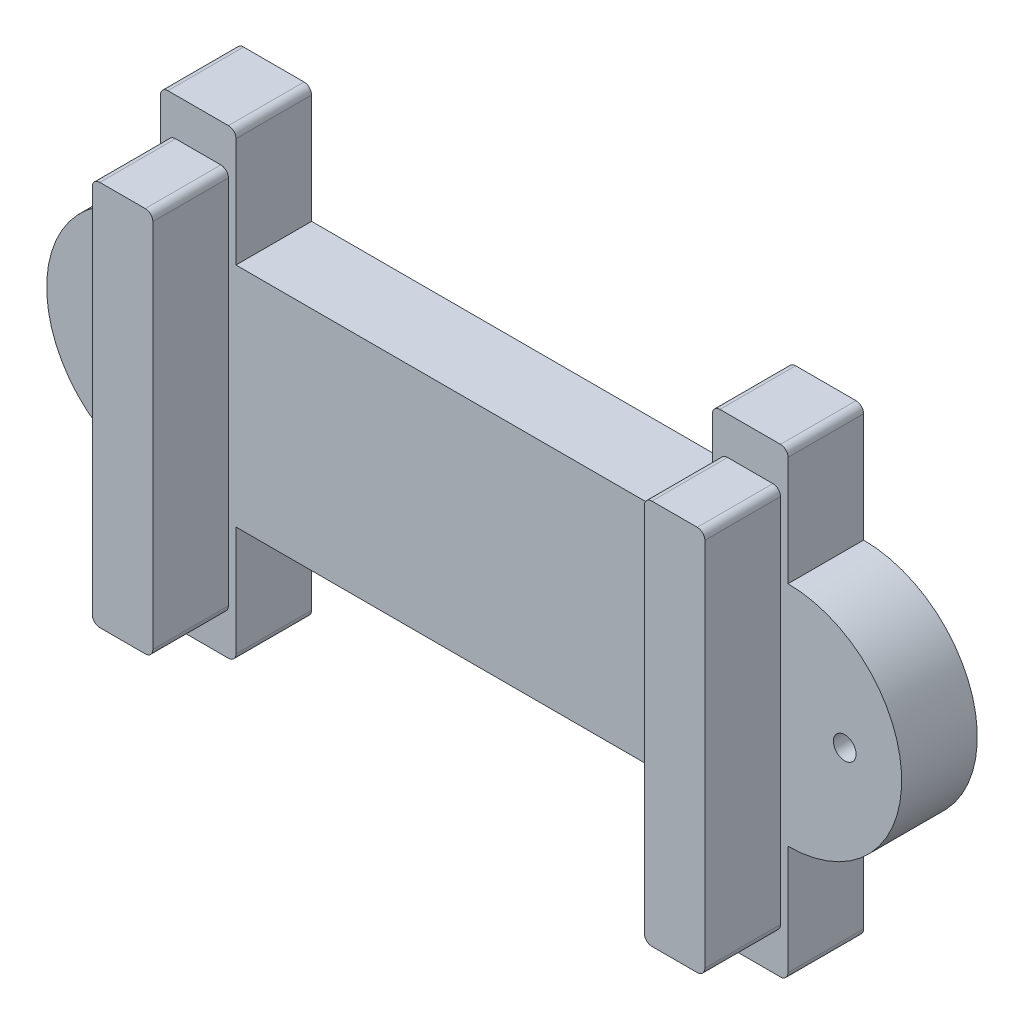
from build123d import *

# Parameters (mm, degrees)
SKETCH1_R           = 1.5
BOSS_EXTRUDE1_DEPTH = 10
BOSS_EXTRUDE2_DEPTH = 10


with BuildPart() as part:
    # Sketch1 → Boss-Extrude1 (new body)
    with BuildSketch(Plane.XY):
        with BuildLine():
            Line((31.5, -15), (-31.5, -15))
            Line((-31.5, -15), (-31.5, -29.533829211))
            ThreePointArc((-31.5, -29.533829211), (-31.792893219, -30.240935993), (-32.5, -30.533829211))
            Line((-32.5, -30.533829211), (-40.5, -30.533829211))
            ThreePointArc((-40.5, -30.533829211), (-41.207106781, -30.240935993), (-41.5, -29.533829211))
            Line((-41.5, -29.533829211), (-41.5, -15.067658423))
            ThreePointArc((-41.5, -15.067658423), (-56.533829211, -0.033829211), (-41.5, 15))
            Line((-41.5, 15), (-41.5, 29.466170789))
            ThreePointArc((-41.5, 29.466170789), (-41.207106781, 30.17327757), (-40.5, 30.466170789))
            Line((-40.5, 30.466170789), (-32.5, 30.466170789))
            ThreePointArc((-32.5, 30.466170789), (-31.792893219, 30.17327757), (-31.5, 29.466170789))
            Line((-31.5, 29.466170789), (-31.5, 15))
            Line((-31.5, 15), (31.5, 15))
            Line((31.5, 15), (31.5, 29.466170789))
            ThreePointArc((31.5, 29.466170789), (31.792893219, 30.17327757), (32.5, 30.466170789))
            Line((32.5, 30.466170789), (40.5, 30.466170789))
            ThreePointArc((40.5, 30.466170789), (41.207106781, 30.17327757), (41.5, 29.466170789))
            Line((41.5, 29.466170789), (41.5, 15))
            ThreePointArc((41.5, 15), (56.533829211, -0.033829211), (41.5, -15.067658423))
            Line((41.5, -15.067658423), (41.5, -29.533829211))
            ThreePointArc((41.5, -29.533829211), (41.207106781, -30.240935993), (40.5, -30.533829211))
            Line((40.5, -30.533829211), (32.5, -30.533829211))
            ThreePointArc((32.5, -30.533829211), (31.792893219, -30.240935993), (31.5, -29.533829211))
            Line((31.5, -29.533829211), (31.5, -15))
        make_face()
        with Locations((-49, -0.033829211)):
            Circle(SKETCH1_R, mode=Mode.SUBTRACT)
        with Locations(Location((49, -0.033829211, 0), (0, 0, 180))):
            Circle(SKETCH1_R, mode=Mode.SUBTRACT)
    extrude(amount=BOSS_EXTRUDE1_DEPTH)

    # Sketch2 → Boss-Extrude2 (add)
    with BuildSketch(Plane.XY.offset(10)):
        with BuildLine():
            Line((-33.499984323, -25.533829211), (-39.499984323, -25.533829211))
            ThreePointArc((-39.499984323, -25.533829211), (-40.207091104, -25.240935993), (-40.499984323, -24.533829211))
            Line((-40.499984323, -24.533829211), (-40.499984323, 24.466170789))
            ThreePointArc((-40.499984323, 24.466170789), (-40.207091104, 25.17327757), (-39.499984323, 25.466170789))
            Line((-39.499984323, 25.466170789), (-33.499984323, 25.466170789))
            ThreePointArc((-33.499984323, 25.466170789), (-32.792877542, 25.17327757), (-32.499984323, 24.466170789))
            Line((-32.499984323, 24.466170789), (-32.499984323, -24.533829211))
            ThreePointArc((-32.499984323, -24.533829211), (-32.792877542, -25.240935993), (-33.499984323, -25.533829211))
        make_face()
        with BuildLine():
            Line((33.499984323, 25.466170789), (39.499984323, 25.466170789))
            ThreePointArc((39.499984323, 25.466170789), (40.207091104, 25.17327757), (40.499984323, 24.466170789))
            Line((40.499984323, 24.466170789), (40.499984323, -24.533829211))
            ThreePointArc((40.499984323, -24.533829211), (40.207091104, -25.240935993), (39.499984323, -25.533829211))
            Line((39.499984323, -25.533829211), (33.499984323, -25.533829211))
            ThreePointArc((33.499984323, -25.533829211), (32.792877542, -25.240935993), (32.499984323, -24.533829211))
            Line((32.499984323, -24.533829211), (32.499984323, 24.466170789))
            ThreePointArc((32.499984323, 24.466170789), (32.792877542, 25.17327757), (33.499984323, 25.466170789))
        make_face()
    extrude(amount=BOSS_EXTRUDE2_DEPTH)


solid = part.part
